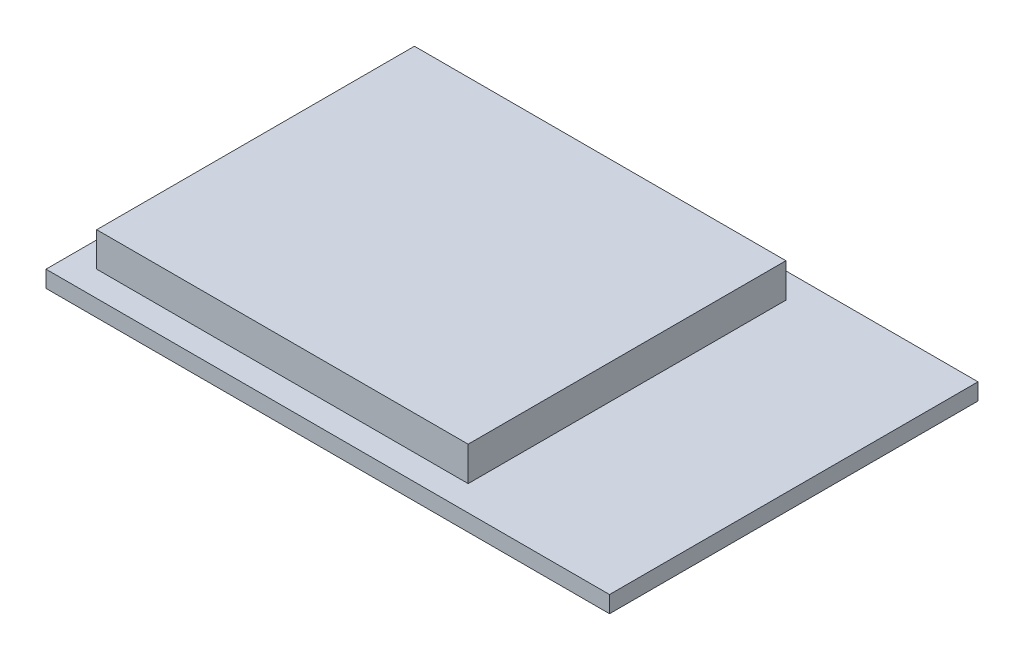
from build123d import *

# Parameters (mm, degrees)
SKETCH1_W           = 33.8
SKETCH1_H           = 22.1
BOSS_EXTRUDE1_DEPTH = 1
SKETCH2_2_W         = 22.28
SKETCH2_2_H         = 19.06
BOSS_EXTRUDE3_DEPTH = 3.05


with BuildPart() as part:
    # Sketch1 → Boss-Extrude1 (new body)
    with BuildSketch(Plane(origin=(0, 0, 0), x_dir=(1, 0, 0), z_dir=(0, 1, 0))):
        with Locations((16.9, 0)):
            Rectangle(SKETCH1_W, SKETCH1_H)
    extrude(amount=BOSS_EXTRUDE1_DEPTH)

    # Sketch2<2> → Boss-Extrude3 (add)
    with BuildSketch(Plane(origin=(0, 0, 0), x_dir=(1, 0, 0), z_dir=(0, 1, 0))):
        with Locations((12.66, 0)):
            Rectangle(SKETCH2_2_W, SKETCH2_2_H)
    extrude(amount=BOSS_EXTRUDE3_DEPTH)


solid = part.part
